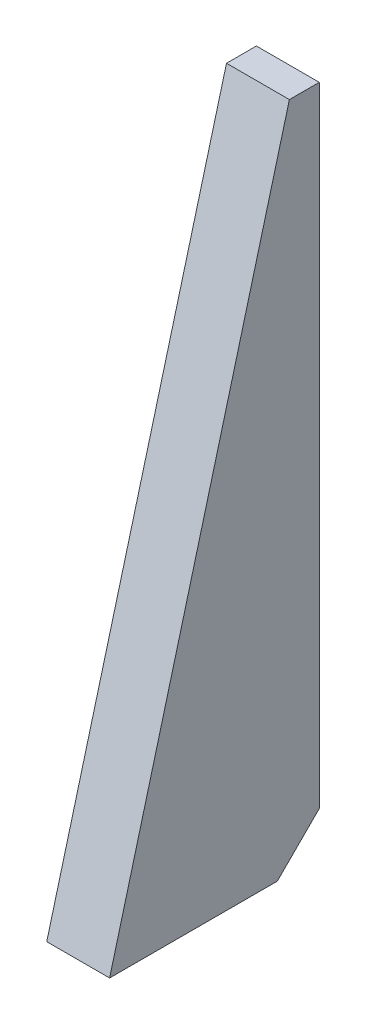
from build123d import *

# Parameters (mm, degrees)
BOSS_EXTRUDE1_DEPTH = 15


with BuildPart() as part:
    # Sketch1 → Boss-Extrude1 (new body)
    with BuildSketch(Plane(origin=(0, 0, 0), x_dir=(0, 0, -1), z_dir=(1, 0, 0))):
        Polygon((-10, 0), (-50, 0), (-7.128129211, 160), (0, 160), (0, 10), align=None)
    extrude(amount=BOSS_EXTRUDE1_DEPTH)


solid = part.part
